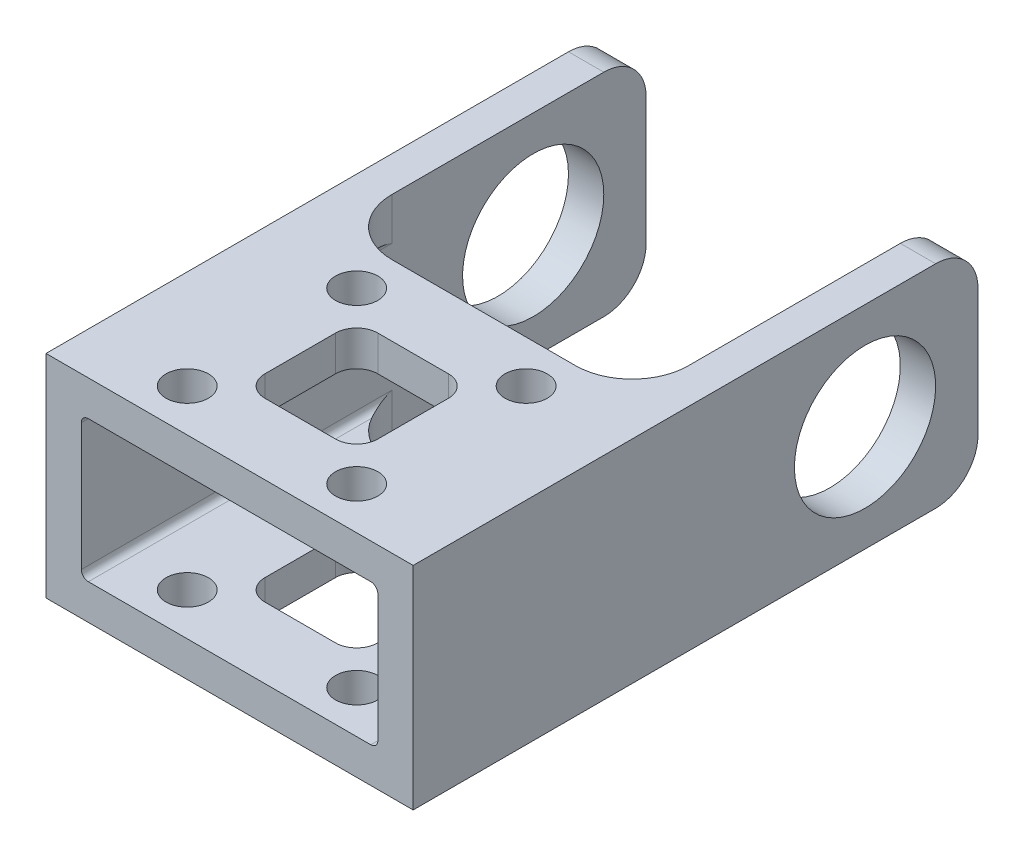
from build123d import *

# Parameters (mm, degrees)
SKETCH_1_W               = 23
SKETCH_1_H               = 15
EXTRUDE_1_DEPTH          = 40
SKETCH_2_W               = 20
SKETCH_2_H               = 10
CUT_EXTRUDE_2_DEPTH      = 68
SKETCH_5_W               = 20
SKETCH_5_H               = 22
CUT_EXTRUDE_5_DEPTH      = 20
SKETCH_6_R               = 5
CUT_EXTRUDE_6_DEPTH      = 20
SKETCH_7_R               = 1.5
CUT_EXTRUDE_7_DEPTH      = 20
SKETCH_8_W               = 3
SKETCH_8_H               = 15
EXTRUDE_2_DEPTH          = 40
SKETCH_9_W               = 21
SKETCH_9_H               = 10
CUT_EXTRUDE_8_DEPTH      = 100
CUT_EXTRUDE_9_DEPTH      = 20.5
CUT_EXTRUDE_9_DEPTH_BACK = 0.5
SKETCH_10_W              = 22
SKETCH_10_H              = 2.5
FILLET_4_R               = 0.5
CUT_EXTRUDE_START        = -4.5
SKETCH_11_R              = 5
CUT_EXTRUDE_10_DEPTH     = 4.5
FILLET_5_R               = 4
FILLET_6_R               = 3


with BuildPart() as part:
    # 草图1 → 凸台-拉伸1 (new body)
    with BuildSketch(Plane.XY):
        with Locations((11.5, 7.5)):
            Rectangle(SKETCH_1_W, SKETCH_1_H)
    extrude(amount=EXTRUDE_1_DEPTH)

    # 草图2 → 切除-拉伸2 (cut)
    with BuildSketch(Plane.XY.offset(40)):
        with Locations((13, 7.5)):
            Rectangle(SKETCH_2_W, SKETCH_2_H)
    extrude(amount=-CUT_EXTRUDE_2_DEPTH, mode=Mode.SUBTRACT)

    # 草图5 → 切除-拉伸5 (cut)
    with BuildSketch(Plane.XZ):
        with Locations((13, 11)):
            Rectangle(SKETCH_5_W, SKETCH_5_H)
    extrude(amount=-CUT_EXTRUDE_5_DEPTH, mode=Mode.SUBTRACT)

    # 草图6 → 切除-拉伸6 (cut)
    with BuildSketch(Plane(origin=(3, 0, 0), x_dir=(0, 0, -1), z_dir=(1, 0, 0))):
        with Locations(Location((-8, 7.5, 0), (0, 0, 90))):
            Circle(SKETCH_6_R)
    extrude(amount=-CUT_EXTRUDE_6_DEPTH, mode=Mode.SUBTRACT)

    # 草图7 → 切除-拉伸7 (cut)
    with BuildSketch(Plane.XZ):
        with Locations(Location((7, 37, 0), (0, 0, 270))):
            Circle(SKETCH_7_R)
        with Locations(Location((19, 37, 0), (0, 0, 270))):
            Circle(SKETCH_7_R)
        with Locations(Location((7, 25, 0), (0, 0, 270))):
            Circle(SKETCH_7_R)
        with Locations(Location((19, 25, 0), (0, 0, 270))):
            Circle(SKETCH_7_R)
        with BuildLine():
            Line((10.5, 27), (15.5, 27))
            ThreePointArc((15.5, 27), (16.560660172, 27.439339828), (17, 28.5))
            Line((17, 28.5), (17, 33.5))
            ThreePointArc((17, 33.5), (16.560660172, 34.560660172), (15.5, 35))
            Line((15.5, 35), (10.5, 35))
            ThreePointArc((10.5, 35), (9.439339828, 34.560660172), (9, 33.5))
            Line((9, 33.5), (9, 28.5))
            ThreePointArc((9, 28.5), (9.439339828, 27.439339828), (10.5, 27))
        make_face()
    extrude(amount=-CUT_EXTRUDE_7_DEPTH, mode=Mode.SUBTRACT)

    # 草图8 → 凸台-拉伸2 (add)
    with BuildSketch(Plane.XY.offset(40)):
        with Locations((24.5, 7.5)):
            Rectangle(SKETCH_8_W, SKETCH_8_H)
    extrude(amount=-EXTRUDE_2_DEPTH)

    # 草图9 → 切除-拉伸8 (cut)
    with BuildSketch(Plane.XY.offset(40)):
        with Locations((13, 7.5)):
            Rectangle(SKETCH_9_W, SKETCH_9_H)
    extrude(amount=-CUT_EXTRUDE_8_DEPTH, mode=Mode.SUBTRACT)

    # 草图10 → 切除-拉伸9 (cut, two sides: drawn at the far end of the back side and taken through both)
    with BuildSketch(Plane.ZY.offset(-23).offset(-CUT_EXTRUDE_9_DEPTH_BACK)):
        with Locations((11, 13.75)):
            Rectangle(SKETCH_10_W, SKETCH_10_H)
        with Locations((11, 1.25)):
            Rectangle(SKETCH_10_W, SKETCH_10_H)
    extrude(amount=CUT_EXTRUDE_9_DEPTH + CUT_EXTRUDE_9_DEPTH_BACK, mode=Mode.SUBTRACT)

    # 圆角4
    fillet_4_edges = [part.edges().sort_by_distance(p)[0] for p in [
        (2.5, 12.5, 31),
        (2.5, 2.5, 31),
        (23.5, 2.5, 31),
        (23.5, 12.5, 31),
    ]]
    fillet(fillet_4_edges, radius=FILLET_4_R)

    # 草图11 → 切除-拉伸10 (cut)
    with BuildSketch(Plane.ZY.offset(-23.5).offset(CUT_EXTRUDE_START)):
        with Locations(Location((8, 7.5, 0), (0, 0, 180))):
            Circle(SKETCH_11_R)
    extrude(amount=CUT_EXTRUDE_10_DEPTH, mode=Mode.SUBTRACT)

    # 圆角5
    fillet_5_edges = [part.edges().sort_by_distance(p)[0] for p in [
        (23.5, 13.5, 22),
        (23.5, 1.5, 22),
        (2.5, 13.5, 22),
        (2.5, 1.5, 22),
    ]]
    fillet(fillet_5_edges, radius=FILLET_5_R)

    # 圆角6
    fillet_6_edges = [part.edges().sort_by_distance(p)[0] for p in [
        (24.75, 15, 0),
        (24.75, 0, 0),
        (1.25, 15, 0),
        (1.25, 0, 0),
    ]]
    fillet(fillet_6_edges, radius=FILLET_6_R)


solid = part.part
